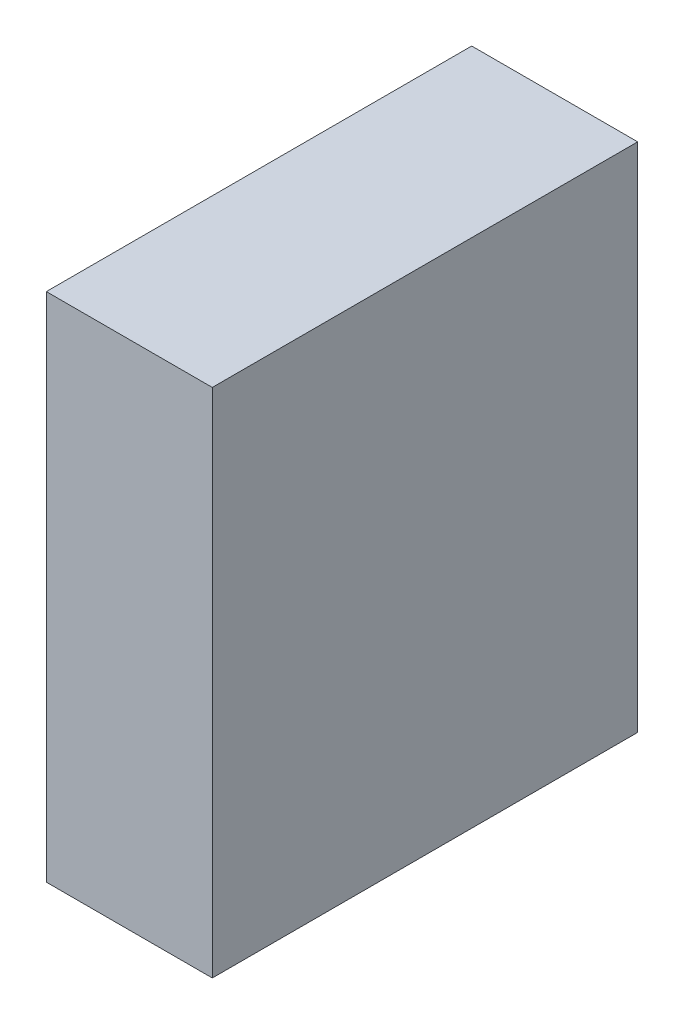
from build123d import *

# Parameters (mm, degrees)
SKETCH2_W           = 12.9
SKETCH2_H           = 39.75
BOSS_EXTRUDE1_DEPTH = 33.06


with BuildPart() as part:
    # Sketch2 → Boss-Extrude1 (new body)
    with BuildSketch(Plane.XY):
        with Locations((6.45, -19.875)):
            Rectangle(SKETCH2_W, SKETCH2_H)
    extrude(amount=BOSS_EXTRUDE1_DEPTH)


solid = part.part
